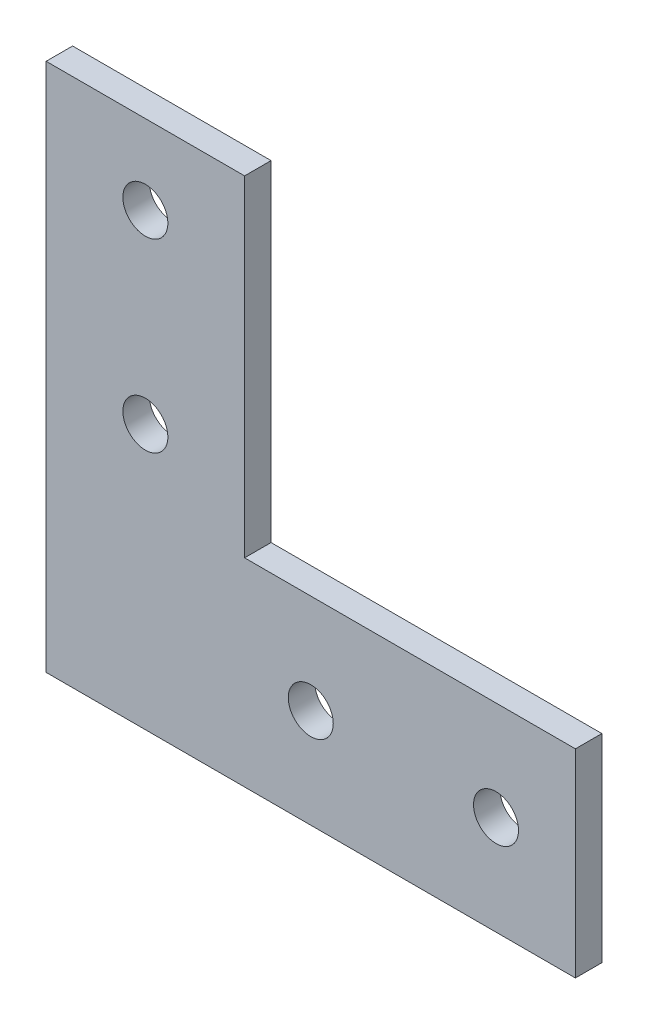
from build123d import *

# Parameters (mm, degrees)
SKETCH_1_R      = 1.7
EXTRUDE_1_DEPTH = 2


with BuildPart() as part:
    # 草图1 → 凸台-拉伸1 (new body)
    with BuildSketch(Plane.XY):
        Polygon((0, 0), (40, 0), (40, 15), (15, 15), (15, 40), (0, 40), align=None)
        with Locations((20, 7.5)):
            Circle(SKETCH_1_R, mode=Mode.SUBTRACT)
        with Locations((34, 7.5)):
            Circle(SKETCH_1_R, mode=Mode.SUBTRACT)
        with Locations(Location((7.5, 34, 0), (0, 0, 180))):
            Circle(SKETCH_1_R, mode=Mode.SUBTRACT)
        with Locations(Location((7.5, 20, 0), (0, 0, 180))):
            Circle(SKETCH_1_R, mode=Mode.SUBTRACT)
    extrude(amount=EXTRUDE_1_DEPTH)


solid = part.part
